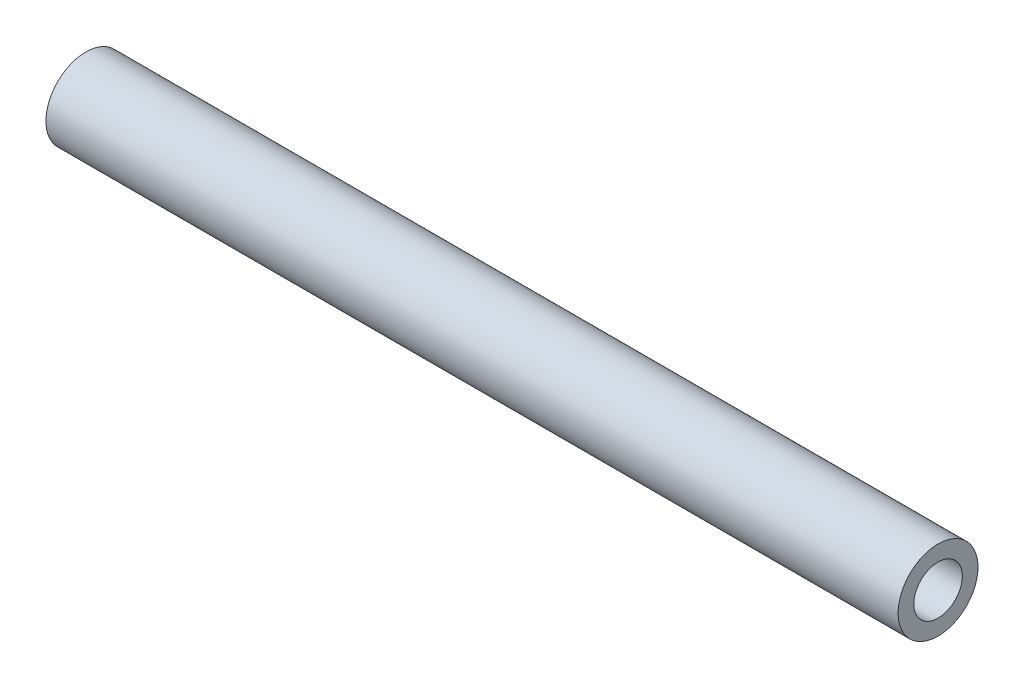
from build123d import *

# Parameters (mm, degrees)
SKETCH1_R           = 4.7625
SKETCH1_R_2         = 2.8956
BOSS_EXTRUDE1_DEPTH = 101.6


with BuildPart() as part:
    # Sketch1 → Boss-Extrude1 (new body)
    with BuildSketch(Plane(origin=(0, 0, 0), x_dir=(0, 0, -1), z_dir=(1, 0, 0))):
        Circle(SKETCH1_R)
        Circle(SKETCH1_R_2, mode=Mode.SUBTRACT)
    extrude(amount=BOSS_EXTRUDE1_DEPTH)


solid = part.part
